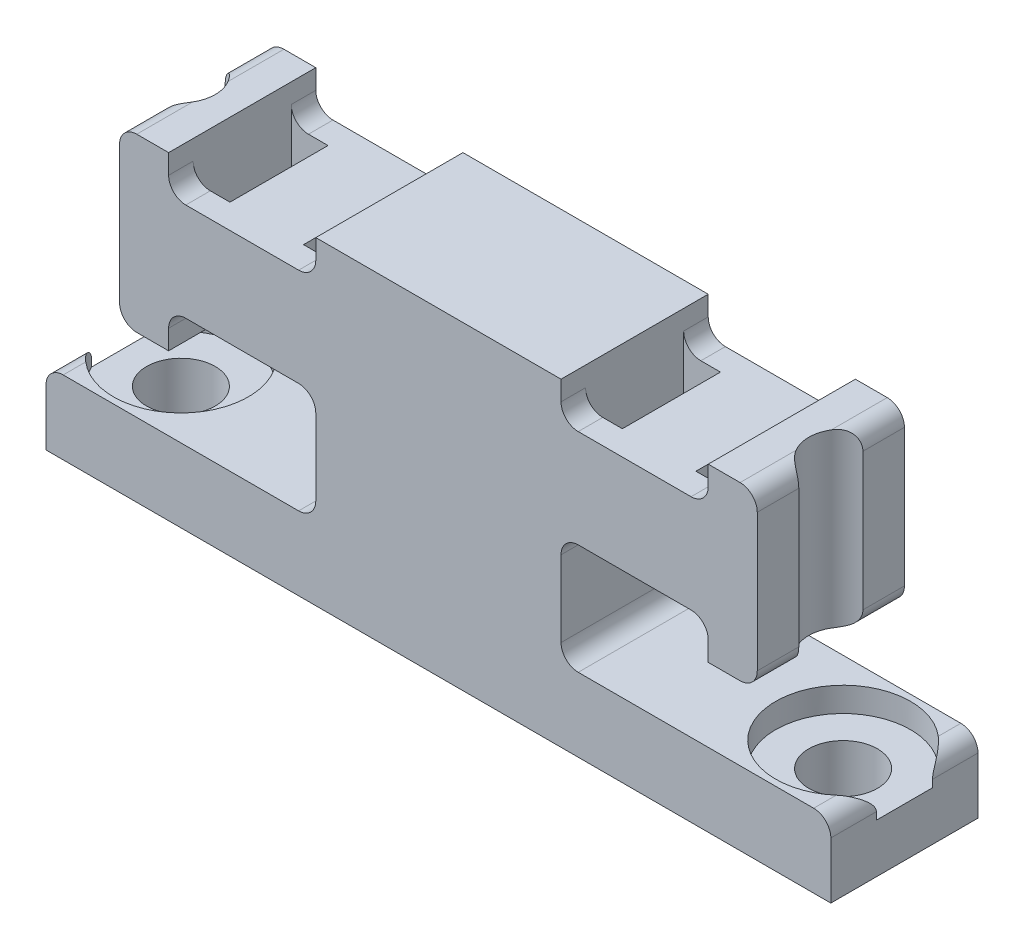
from build123d import *

# Parameters (mm, degrees)
BOSS_EXTRUDE1_DEPTH     = 6
SKETCH4_W               = 6
SKETCH4_H               = 1.5
CUT_EXTRUDE2_DEPTH      = 22.470910554
FILLET1_R               = 0.7
CUT_EXTRUDE1_DEPTH      = 20.798989873
CUT_EXTRUDE1_DEPTH_BACK = 20.798989873
SKETCH2_R               = 1.4
CUT_EXTRUDE3_REACH      = 23.471
SKETCH5_W               = 1.5
SKETCH5_H               = 4
SKETCH6_R               = 2.75
CUT_EXTRUDE5_DEPTH      = 1


with BuildPart() as part:
    # Sketch1 → Boss-Extrude1 (new body)
    with BuildSketch(Plane.XY):
        Polygon((13, 13), (-13, 13), (-13, 6), (-5, 6), (-5, 3), (-16, 3), (-16, 0), (16, 0), (16, 3), (5, 3), (5, 6), (13, 6), align=None)
    extrude(amount=BOSS_EXTRUDE1_DEPTH)

    # Sketch4 → Cut-Extrude2 (cut, through all)
    with BuildSketch(Plane.XY.offset(6)):
        with Locations((-8, 6.75)):
            Rectangle(SKETCH4_W, SKETCH4_H)
        with Locations((-8, 12.25)):
            Rectangle(SKETCH4_W, SKETCH4_H)
        with Locations((8, 12.25)):
            Rectangle(SKETCH4_W, SKETCH4_H)
        with Locations((8, 6.75)):
            Rectangle(SKETCH4_W, SKETCH4_H)
    extrude(amount=-CUT_EXTRUDE2_DEPTH, mode=Mode.SUBTRACT)

    # Fillet1
    fillet1_edges = [part.edges().sort_by_distance(p)[0] for p in [
        (-13, 6, 3),
        (-13, 13, 3),
        (13, 13, 3),
        (13, 6, 3),
        (5, 3, 3),
        (16, 3, 3),
        (-16, 3, 3),
        (-5, 3, 3),
        (5, 7.5, 3),
        (11, 7.5, 3),
        (11, 11.5, 3),
        (5, 11.5, 3),
        (-11, 11.5, 3),
        (-5, 11.5, 3),
        (-11, 7.5, 3),
        (-5, 7.5, 3),
    ]]
    fillet(fillet1_edges, radius=FILLET1_R)

    # Sketch2 → Cut-Extrude1 (cut, two sides: drawn at the far end of the back side and taken through both)
    with BuildSketch(Plane(origin=(0, 3, 0), x_dir=(1, 0, 0), z_dir=(0, 1, 0)).offset(-CUT_EXTRUDE1_DEPTH_BACK)):
        with Locations(Location((-13.5, -3, 0), (0, 0, 180))):
            Circle(SKETCH2_R)
        with Locations(Location((13.5, -3, 0), (0, 0, 180))):
            Circle(SKETCH2_R)
    extrude(amount=CUT_EXTRUDE1_DEPTH + CUT_EXTRUDE1_DEPTH_BACK, mode=Mode.SUBTRACT)

    # Sketch5 → Cut-Extrude3 (cut, up to next)
    with BuildSketch(Plane(origin=(0, 13, 0), x_dir=(1, 0, 0), z_dir=(0, 1, 0)), mode=Mode.PRIVATE) as cut_extrude3_sk1:
        with Locations((-10.25, -3)):
            Rectangle(SKETCH5_W, SKETCH5_H)
    cut_extrude3_tool1 = extrude(cut_extrude3_sk1.sketch, amount=-CUT_EXTRUDE3_REACH, mode=Mode.PRIVATE) & part.part
    # Sketch5 → Cut-Extrude3 (cut, up to next)
    with BuildSketch(Plane(origin=(0, 13, 0), x_dir=(1, 0, 0), z_dir=(0, 1, 0)), mode=Mode.PRIVATE) as cut_extrude3_sk2:
        with Locations((-5.75, -3)):
            Rectangle(SKETCH5_W, SKETCH5_H)
    cut_extrude3_tool2 = extrude(cut_extrude3_sk2.sketch, amount=-CUT_EXTRUDE3_REACH, mode=Mode.PRIVATE) & part.part
    # Sketch5 → Cut-Extrude3 (cut, up to next)
    with BuildSketch(Plane(origin=(0, 13, 0), x_dir=(1, 0, 0), z_dir=(0, 1, 0)), mode=Mode.PRIVATE) as cut_extrude3_sk3:
        with Locations((5.75, -3)):
            Rectangle(SKETCH5_W, SKETCH5_H)
    cut_extrude3_tool3 = extrude(cut_extrude3_sk3.sketch, amount=-CUT_EXTRUDE3_REACH, mode=Mode.PRIVATE) & part.part
    # Sketch5 → Cut-Extrude3 (cut, up to next)
    with BuildSketch(Plane(origin=(0, 13, 0), x_dir=(1, 0, 0), z_dir=(0, 1, 0)), mode=Mode.PRIVATE) as cut_extrude3_sk4:
        with Locations((10.25, -3)):
            Rectangle(SKETCH5_W, SKETCH5_H)
    cut_extrude3_tool4 = extrude(cut_extrude3_sk4.sketch, amount=-CUT_EXTRUDE3_REACH, mode=Mode.PRIVATE) & part.part
    add(cut_extrude3_tool1.solids().sort_by_distance((-10.25, 13, 3))[0], mode=Mode.SUBTRACT)
    add(cut_extrude3_tool2.solids().sort_by_distance((-5.75, 13, 3))[0], mode=Mode.SUBTRACT)
    add(cut_extrude3_tool3.solids().sort_by_distance((5.75, 13, 3))[0], mode=Mode.SUBTRACT)
    add(cut_extrude3_tool4.solids().sort_by_distance((10.25, 13, 3))[0], mode=Mode.SUBTRACT)

    # Sketch6 → Cut-Extrude5 (cut)
    with BuildSketch(Plane(origin=(0, 3, 0), x_dir=(1, 0, 0), z_dir=(0, 1, 0))):
        with Locations((13.5, -3)):
            Circle(SKETCH6_R)
        with Locations((-13.5, -3)):
            Circle(SKETCH6_R)
    extrude(amount=-CUT_EXTRUDE5_DEPTH, mode=Mode.SUBTRACT)


solid = part.part
